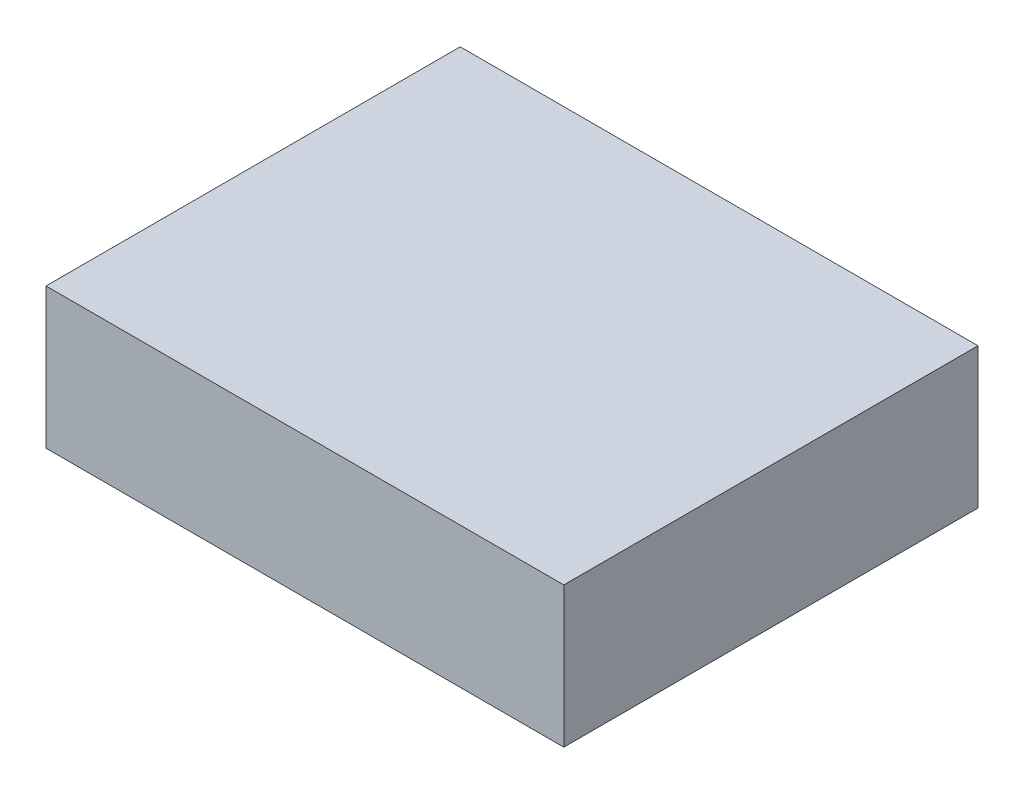
from build123d import *

# Parameters (mm, degrees)
SKETCH_1_W      = 70
SKETCH_1_H      = 56
EXTRUDE_1_DEPTH = 19


with BuildPart() as part:
    # 草图1 → 凸台-拉伸1 (new body)
    with BuildSketch(Plane(origin=(0, 0, 0), x_dir=(1, 0, 0), z_dir=(0, 1, 0))):
        with Locations((35, 28)):
            Rectangle(SKETCH_1_W, SKETCH_1_H)
    extrude(amount=EXTRUDE_1_DEPTH)


solid = part.part
